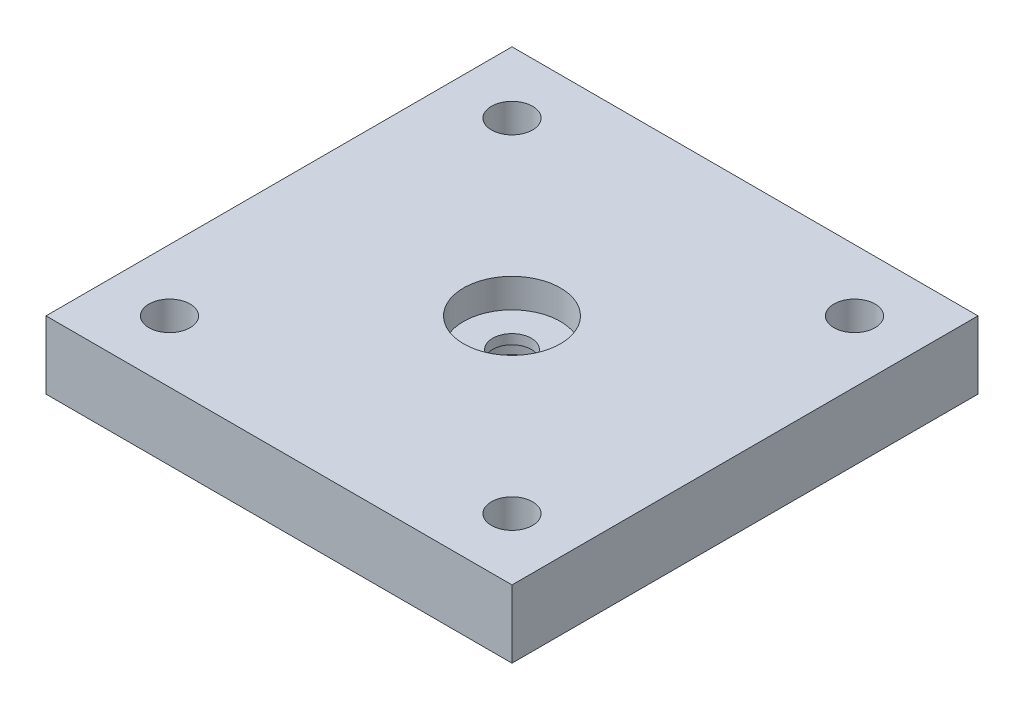
from build123d import *

# Parameters (mm, degrees)
SKETCH1_W           = 96.210678118
SKETCH1_H           = 96.210678118
SKETCH1_R           = 4.25
SKETCH1_R_2         = 4
BOSS_EXTRUDE1_DEPTH = 14
SKETCH2_R           = 10
CUT_EXTRUDE1_DEPTH  = 6
CUT_EXTRUDE2_START  = -6
SKETCH3_R           = 10
CUT_EXTRUDE2_DEPTH  = 6


with BuildPart() as part:
    # Sketch1 → Boss-Extrude1 (new body)
    with BuildSketch(Plane(origin=(0, 0, 0), x_dir=(1, 0, 0), z_dir=(0, 1, 0))):
        Rectangle(SKETCH1_W, SKETCH1_H)
        with Locations(Location((-35.355339059, 35.355339059, 0), (0, 0, 270))):
            Circle(SKETCH1_R, mode=Mode.SUBTRACT)
        with Locations(Location((35.355339059, 35.355339059, 0), (0, 0, 270))):
            Circle(SKETCH1_R, mode=Mode.SUBTRACT)
        with Locations(Location((35.355339059, -35.355339059, 0), (0, 0, 270))):
            Circle(SKETCH1_R, mode=Mode.SUBTRACT)
        with Locations(Location((-35.355339059, -35.355339059, 0), (0, 0, 270))):
            Circle(SKETCH1_R, mode=Mode.SUBTRACT)
        with Locations(Location((0, 0, 0), (0, 0, 270))):
            Circle(SKETCH1_R_2, mode=Mode.SUBTRACT)
    extrude(amount=BOSS_EXTRUDE1_DEPTH)

    # Sketch2 → Cut-Extrude1 (cut)
    with BuildSketch(Plane(origin=(0, 14, 0), x_dir=(1, 0, 0), z_dir=(0, 1, 0))):
        with Locations(Location((0, 0, 0), (0, 0, 270))):
            Circle(SKETCH2_R)
    extrude(amount=-CUT_EXTRUDE1_DEPTH, mode=Mode.SUBTRACT)

    # Sketch3 → Cut-Extrude2 (cut)
    with BuildSketch(Plane.XZ.offset(CUT_EXTRUDE2_START)):
        with Locations(Location((0, 0, 0), (0, 0, 90))):
            Circle(SKETCH3_R)
    extrude(amount=CUT_EXTRUDE2_DEPTH, mode=Mode.SUBTRACT)


solid = part.part
